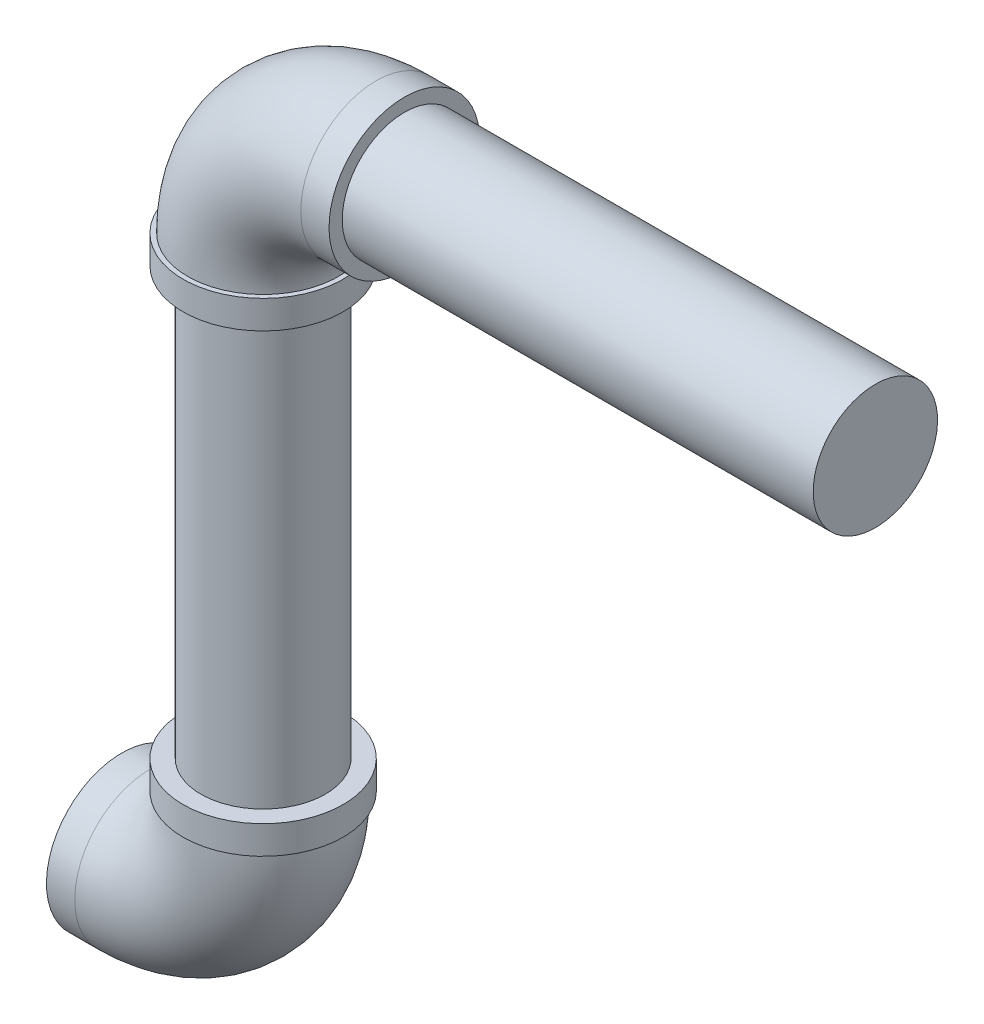
from build123d import *

# Parameters (mm, degrees)
SKETCH1_R           = 16.764
BOSS_EXTRUDE1_DEPTH = 57.531
SKETCH3_R           = 21.59
BOSS_EXTRUDE2_DEPTH = 7.62
SKETCH5_R           = 20.32
SKETCH6_R           = 20.32
BOSS_EXTRUDE3_DEPTH = 7.62
CIRPATTERN1_COUNT   = 2
SKETCH9_R           = 16.764
BOSS_EXTRUDE4_DEPTH = 127


with BuildPart() as part:
    # Sketch1 → Boss-Extrude1 (new, symmetric)
    with BuildSketch(Plane(origin=(0, 0, 0), x_dir=(1, 0, 0), z_dir=(0, 1, 0))):
        with Locations(Location((0, 0, 0), (0, 0, 90))):
            Circle(SKETCH1_R)
    extrude(amount=BOSS_EXTRUDE1_DEPTH, both=True)

    # Sketch3 → Boss-Extrude2 (add)
    with BuildSketch(Plane(origin=(0, 57.531, 0), x_dir=(1, 0, 0), z_dir=(0, 1, 0))):
        with Locations(Location((0, 0, 0), (0, 0, 90))):
            Circle(SKETCH3_R)
    boss_extrude2 = extrude(amount=BOSS_EXTRUDE2_DEPTH)

    # Sweep1: sweep along a path in Sketch4
    with BuildLine(Plane.XY) as sweep1_path:
        ThreePointArc((0, 65.151), (8.927385309, 86.703614691), (30.48, 95.631))
    # Sketch5 → Sweep1 (sweep)
    with BuildSketch(Plane(origin=(0, 65.151, 0), x_dir=(1, 0, 0), z_dir=(0, 1, 0))):
        Circle(SKETCH5_R)
    sweep1 = sweep(path=sweep1_path.line)

    # Sketch6 → Boss-Extrude3 (add)
    with BuildSketch(Plane(origin=(30.48, 0, 0), x_dir=(0, 0, -1), z_dir=(1, 0, 0))):
        with Locations(Location((0, 95.631, 0), (0, 0, 90))):
            Circle(SKETCH6_R)
    boss_extrude3 = extrude(amount=BOSS_EXTRUDE3_DEPTH)

    # CirPattern1: Boss-Extrude2, Sweep1, Boss-Extrude3 ×2 about axis
    cirpattern1_axis = Axis((0, 0, 0), (0, 0, 1))
    add([boss_extrude2.rotate(cirpattern1_axis, i * 360 / CIRPATTERN1_COUNT) for i in range(1, CIRPATTERN1_COUNT)])
    add([sweep1.rotate(cirpattern1_axis, i * 360 / CIRPATTERN1_COUNT) for i in range(1, CIRPATTERN1_COUNT)])
    add([boss_extrude3.rotate(cirpattern1_axis, i * 360 / CIRPATTERN1_COUNT) for i in range(1, CIRPATTERN1_COUNT)])

    # Sketch9 → Boss-Extrude4 (add)
    with BuildSketch(Plane(origin=(38.1, 0, 0), x_dir=(0, 0, -1), z_dir=(1, 0, 0))):
        with Locations(Location((0, 95.631, 0), (0, 0, 90))):
            Circle(SKETCH9_R)
    extrude(amount=BOSS_EXTRUDE4_DEPTH)


solid = part.part
